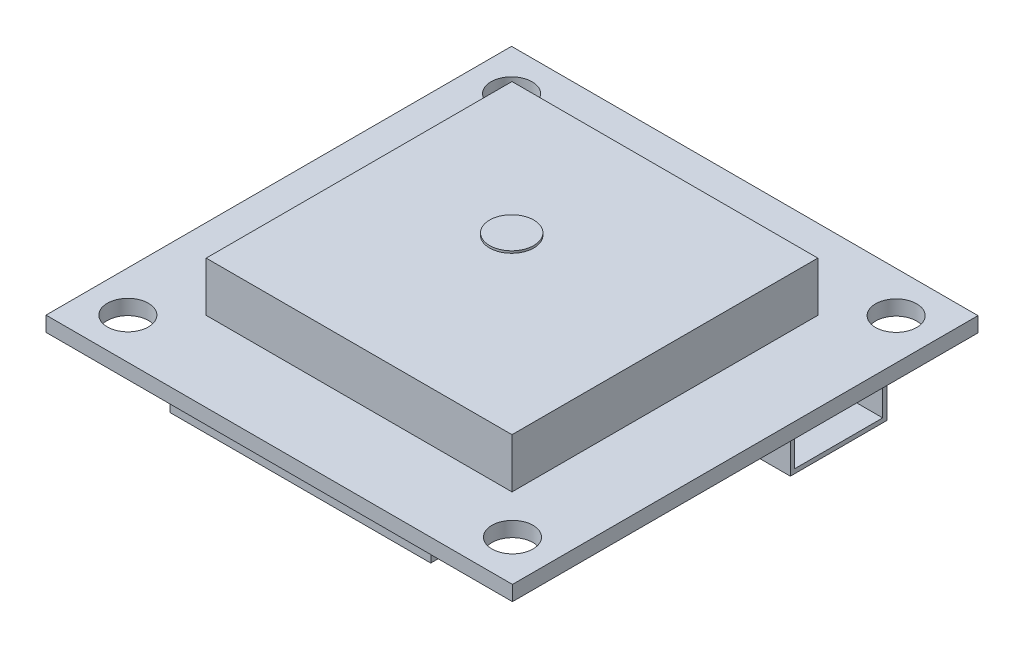
from build123d import *

# Parameters (mm, degrees)
SKETCH1_W           = 38.354
SKETCH1_H           = 38.2778
BOARD_DEPTH         = 1.2319
SKETCH3_W           = 25.146
SKETCH3_H           = 25.146
GPS_DEPTH           = 4.0767
SKETCH5_W           = 21.4376
SKETCH5_H           = 16.7894
UBLOCK_CHIP_DEPTH   = 2.4257
SKETCH6_R           = 3.3782
BATTERY_DEPTH       = 2.1082
SKETCH7_W           = 4.318
SKETCH7_H           = 7.9502
CONNECTOR_DEPTH     = 2.9972
SKETCH8_W           = 7.239
SKETCH8_H           = 2.286
CUT_EXTRUDE1_DEPTH  = 3.7592
CUT_EXTRUDE2_REACH  = 56.352
SKETCH9_R           = 1.6891
SKETCH10_R          = 1.8161
BOSS_EXTRUDE6_DEPTH = 0.1778


with BuildPart() as part:
    # Sketch1 → Board (new body)
    with BuildSketch(Plane(origin=(0, 0, 0), x_dir=(1, 0, 0), z_dir=(0, 1, 0))):
        with Locations((19.177, 19.1389)):
            Rectangle(SKETCH1_W, SKETCH1_H)
    extrude(amount=BOARD_DEPTH)

    # Sketch3 → GPS (add)
    with BuildSketch(Plane(origin=(0, 1.2319, 0), x_dir=(1, 0, 0), z_dir=(0, 1, 0))):
        with Locations((19.177, 19.1389)):
            Rectangle(SKETCH3_W, SKETCH3_H)
    extrude(amount=GPS_DEPTH)

    # Sketch5 → uBlock chip (add)
    with BuildSketch(Plane.XZ):
        with Locations((19.1008, -10.2108)):
            Rectangle(SKETCH5_W, SKETCH5_H)
    extrude(amount=UBLOCK_CHIP_DEPTH)

    # Sketch6 → Battery (add)
    with BuildSketch(Plane(origin=(0, 0, 0), x_dir=(-1, 0, 0), z_dir=(0, -1, 0))):
        with Locations(Location((-22.2758, 32.6263, 0), (0, 0, 90))):
            Circle(SKETCH6_R)
    extrude(amount=BATTERY_DEPTH)

    # Sketch7 → Connector (add)
    with BuildSketch(Plane(origin=(0, 0, 0), x_dir=(-1, 0, 0), z_dir=(0, -1, 0))):
        with Locations((-35.687, 27.3304)):
            Rectangle(SKETCH7_W, SKETCH7_H)
    extrude(amount=CONNECTOR_DEPTH)

    # Sketch8 → Cut-Extrude1 (cut)
    with BuildSketch(Plane(origin=(37.846, 0, 0), x_dir=(0, 0, -1), z_dir=(1, 0, 0))):
        with Locations((27.3304, -1.4986)):
            Rectangle(SKETCH8_W, SKETCH8_H)
    extrude(amount=-CUT_EXTRUDE1_DEPTH, mode=Mode.SUBTRACT)

    # Sketch9 → Cut-Extrude2 (cut, up to next)
    with BuildSketch(Plane(origin=(0, 1.2319, 0), x_dir=(1, 0, 0), z_dir=(0, 1, 0)), mode=Mode.PRIVATE) as cut_extrude2_sk1:
        with Locations(Location((34.9885, 3.3655, 0), (0, 0, 270))):
            Circle(SKETCH9_R)
    cut_extrude2_tool1 = extrude(cut_extrude2_sk1.sketch, amount=-CUT_EXTRUDE2_REACH, mode=Mode.PRIVATE) & part.part
    # Sketch9 → Cut-Extrude2 (cut, up to next)
    with BuildSketch(Plane(origin=(0, 1.2319, 0), x_dir=(1, 0, 0), z_dir=(0, 1, 0)), mode=Mode.PRIVATE) as cut_extrude2_sk2:
        with Locations(Location((3.3655, 3.3655, 0), (0, 0, 270))):
            Circle(SKETCH9_R)
    cut_extrude2_tool2 = extrude(cut_extrude2_sk2.sketch, amount=-CUT_EXTRUDE2_REACH, mode=Mode.PRIVATE) & part.part
    # Sketch9 → Cut-Extrude2 (cut, up to next)
    with BuildSketch(Plane(origin=(0, 1.2319, 0), x_dir=(1, 0, 0), z_dir=(0, 1, 0)), mode=Mode.PRIVATE) as cut_extrude2_sk3:
        with Locations(Location((3.3655, 34.9123, 0), (0, 0, 270))):
            Circle(SKETCH9_R)
    cut_extrude2_tool3 = extrude(cut_extrude2_sk3.sketch, amount=-CUT_EXTRUDE2_REACH, mode=Mode.PRIVATE) & part.part
    # Sketch9 → Cut-Extrude2 (cut, up to next)
    with BuildSketch(Plane(origin=(0, 1.2319, 0), x_dir=(1, 0, 0), z_dir=(0, 1, 0)), mode=Mode.PRIVATE) as cut_extrude2_sk4:
        with Locations(Location((34.9885, 34.9123, 0), (0, 0, 270))):
            Circle(SKETCH9_R)
    cut_extrude2_tool4 = extrude(cut_extrude2_sk4.sketch, amount=-CUT_EXTRUDE2_REACH, mode=Mode.PRIVATE) & part.part
    add(cut_extrude2_tool1.solids().sort_by_distance((34.9885, 1.2319, -3.3655))[0], mode=Mode.SUBTRACT)
    add(cut_extrude2_tool2.solids().sort_by_distance((3.3655, 1.2319, -3.3655))[0], mode=Mode.SUBTRACT)
    add(cut_extrude2_tool3.solids().sort_by_distance((3.3655, 1.2319, -34.9123))[0], mode=Mode.SUBTRACT)
    add(cut_extrude2_tool4.solids().sort_by_distance((34.9885, 1.2319, -34.9123))[0], mode=Mode.SUBTRACT)

    # Sketch10 → Boss-Extrude6 (add)
    with BuildSketch(Plane(origin=(0, 5.3086, 0), x_dir=(1, 0, 0), z_dir=(0, 1, 0))):
        with Locations(Location((17.5387, 20.7518, 0), (0, 0, 90))):
            Circle(SKETCH10_R)
    extrude(amount=BOSS_EXTRUDE6_DEPTH)


solid = part.part
